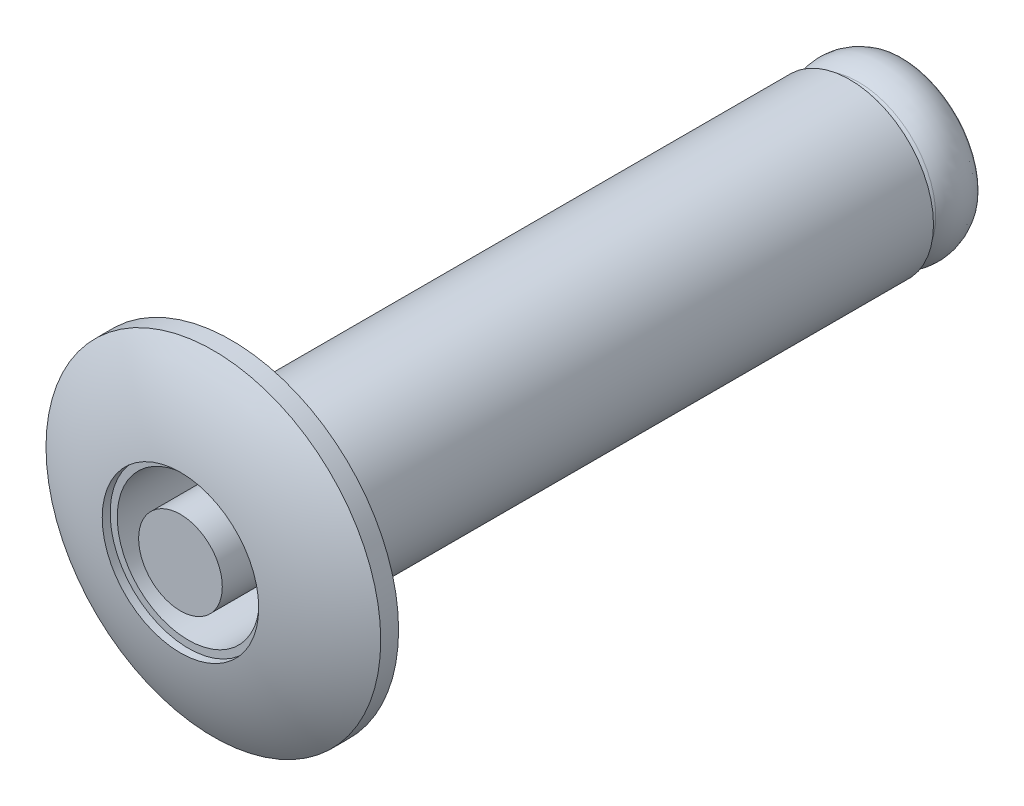
from build123d import *

# Parameters (mm, degrees)
FILLET3_R               = 0.127
SKETCH5_R               = 1.4843125
CUT_EXTRUDE2_DEPTH      = 0.2032
CUT_EXTRUDE1_DEPTH      = 25.893891994
CUT_EXTRUDE1_DEPTH_BACK = 25.893891994
FILLET2_R               = 0.254
CUT_EXTRUDE3_DEPTH      = 25.893891994
CUT_EXTRUDE3_DEPTH_BACK = 25.893891994
SKETCH6_W               = 23.522610405
SKETCH6_H               = 3.175


with BuildPart() as part:
    # Sketch2 → Revolve1 (revolve)
    with BuildSketch(Plane(origin=(0, 0, 0), x_dir=(0, 0, -1), z_dir=(1, 0, 0)), mode=Mode.PRIVATE) as revolve1_sk:
        with BuildLine():
            Line((-24.4856, 0), (-24.4856, 0.79375))
            Line((-24.4856, 0.79375), (-1.016, 0.79375))
            Line((-1.016, 0.79375), (11.8364, 0.79375))
            Line((11.8364, 0.79375), (11.8364, 1.42875))
            ThreePointArc((11.8364, 1.42875), (12.2936, 1.5875), (12.7508, 1.42875))
            Line((12.7508, 1.42875), (12.7508, 0))
            Line((12.7508, 0), (-24.4856, 0))
        make_face()
    revolve(revolve1_sk.sketch.rotate(Axis((0, 0, 24.4856), (0, 0, -1)), 90), axis=Axis((0, 0, 24.4856), (0, 0, -1)))

    # Fillet3
    fillet3_edges = [part.edges().sort_by_distance(p)[0] for p in [
        (-1.42875, 0, -11.8364),
        (-1.42875, 0, -12.7508),
    ]]
    fillet(fillet3_edges, radius=FILLET3_R)

    # Sketch3 → Cut-Extrude1 (cut, two sides: drawn at the far end of the back side and taken through both)
    with BuildSketch(Plane(origin=(0, 0, 0), x_dir=(1, 0, 0), z_dir=(0, 1, 0)).offset(-CUT_EXTRUDE1_DEPTH_BACK)):
        Polygon((0, -24.4856), (0.99695, -23.186349465), (0.99695, -24.9936), (-0.99695, -24.9936), (-0.99695, -23.186349465), align=None)
    extrude(amount=CUT_EXTRUDE1_DEPTH + CUT_EXTRUDE1_DEPTH_BACK, mode=Mode.SUBTRACT)

    # Sketch6 → Cut-Extrude3 (cut, two sides: drawn at the far end of the back side and taken through both)
    with BuildSketch(Plane(origin=(0, 0, 0), x_dir=(0, 0, -1), z_dir=(1, 0, 0)).offset(-CUT_EXTRUDE3_DEPTH_BACK)):
        with Locations((-12.724294798, 0)):
            Rectangle(SKETCH6_W, SKETCH6_H)
    extrude(amount=CUT_EXTRUDE3_DEPTH + CUT_EXTRUDE3_DEPTH_BACK, mode=Mode.SUBTRACT)


with BuildPart() as body_2:
    # Sketch4 → Revolve2 (revolve)
    with BuildSketch(Plane(origin=(0, 0, 0), x_dir=(0, 0, -1), z_dir=(1, 0, 0)), mode=Mode.PRIVATE) as revolve2_sk:
        with BuildLine():
            Line((-0.338666667, 3.175), (0, 3.175))
            Line((0, 3.175), (0, 1.5875))
            Line((0, 1.5875), (11.7348, 1.5875))
            Line((11.7348, 1.5875), (11.7348, 1.349375))
            Line((11.7348, 1.349375), (-0.981753691, 1.349375))
            ThreePointArc((-0.981753691, 1.349375), (-0.7589793, 2.296979497), (-0.338666667, 3.175))
        make_face()
    revolve(revolve2_sk.sketch.rotate(Axis((0, 0, 0), (0, 0, -1)), 90), axis=Axis((0, 0, 0), (0, 0, -1)))

    # Sketch5 → Cut-Extrude2 (cut)
    with BuildSketch(Plane.XY.offset(1.016)):
        Circle(SKETCH5_R)
    extrude(amount=-CUT_EXTRUDE2_DEPTH, mode=Mode.SUBTRACT)

    # Fillet2
    fillet2_edges = [body_2.edges().sort_by_distance(p)[0] for p in [
        (-1.5875, 0, 0),
    ]]
    fillet(fillet2_edges, radius=FILLET2_R)


solid = Compound([part.part, body_2.part])
